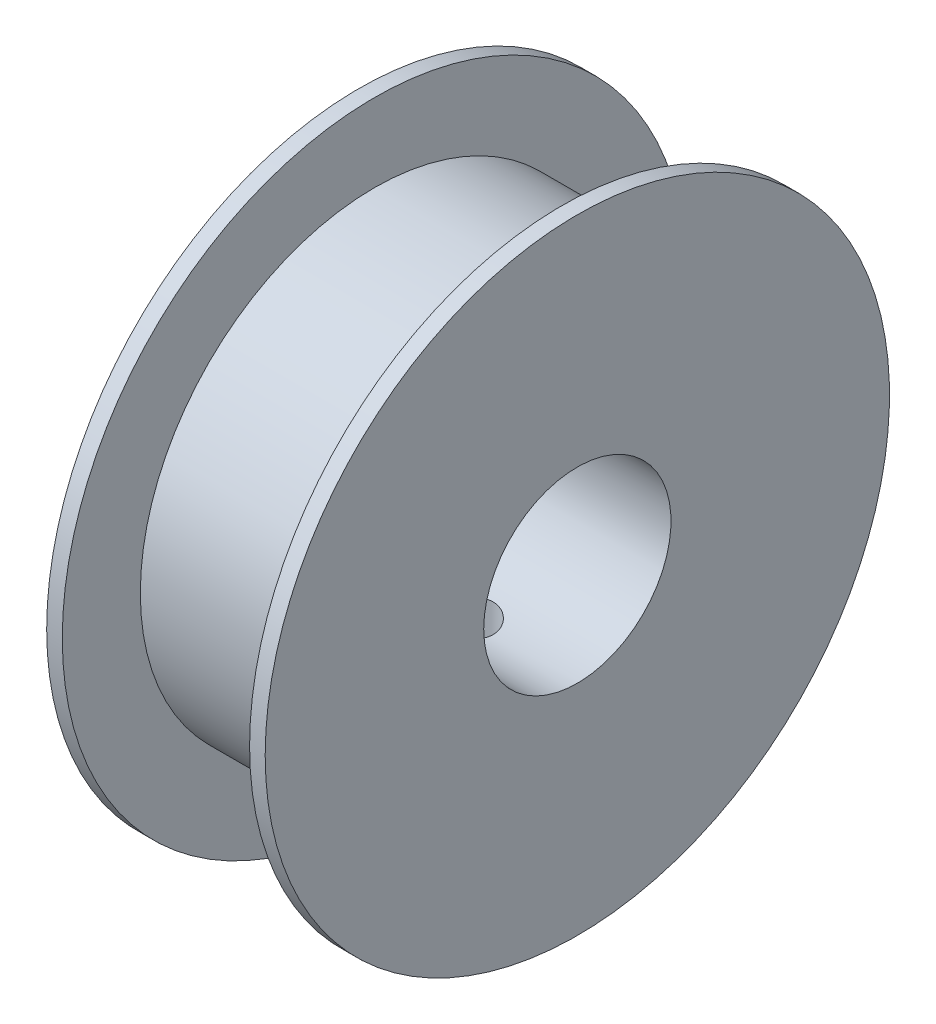
from build123d import *

# Parameters (mm, degrees)
SKETCH_3_R          = 1.6
CUT_EXTRUDE_1_DEPTH = 64.287719075


with BuildPart() as part:
    # ｽｹｯﾁ2 → 回転1 (revolve)
    with BuildSketch(Plane(origin=(0, 0, 0), x_dir=(1, 0, 0), z_dir=(0, 1, 0)), mode=Mode.PRIVATE) as revolve_1_sk:
        Polygon((-44.73085458, -0.056036178), (-44.73085458, -14.056036178), (-30.73085458, -14.056036178), (-30.73085458, -0.056036178), (-31.73085458, -0.056036178), (-31.73085458, -5.056036178), (-43.73085458, -5.056036178), (-43.73085458, -0.056036178), align=None)
    revolve(revolve_1_sk.sketch.rotate(Axis((-49.849406884, 0, 20.056036178), (1, 0, 0)), 180), axis=Axis((-49.849406884, 0, 20.056036178), (1, 0, 0)))

    # ｽｹｯﾁ3 → ｶｯﾄ - 押し出し1 (cut, through all)
    with BuildSketch(Plane(origin=(0, 0, 0), x_dir=(1, 0, 0), z_dir=(0, 1, 0))):
        with Locations(Location((-37.73085458, -20.056036178, 0), (0, 0, 270))):
            Circle(SKETCH_3_R)
    extrude(amount=-CUT_EXTRUDE_1_DEPTH, mode=Mode.SUBTRACT)


solid = part.part
